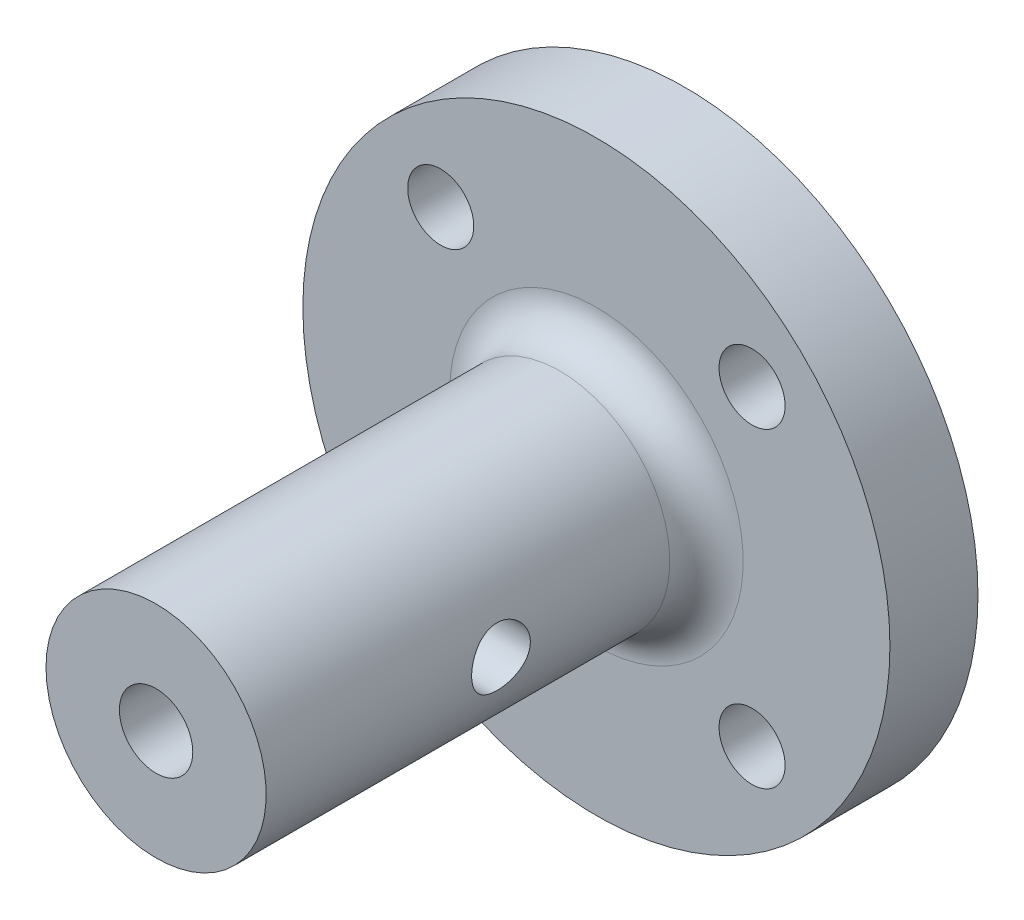
from build123d import *

# Parameters (mm, degrees)
SKETCH_2_R          = 5
CUT_EXTRUDE_1_DEPTH = 20
SKETCH_3_R          = 4
CUT_EXTRUDE_2_DEPTH = 81
SKETCH_4_R          = 4.5
CUT_EXTRUDE_3_DEPTH = 83.462112585
FILLET_1_R          = 5


with BuildPart() as part:
    # 草图1 → 旋转1 (revolve)
    with BuildSketch(Plane(origin=(0, 0, 0), x_dir=(1, 0, 0), z_dir=(0, 1, 0)), mode=Mode.PRIVATE) as revolve_1_sk:
        Polygon((0, 0), (40, 0), (40, -12), (15, -12), (15, -72), (0, -72), align=None)
    revolve(revolve_1_sk.sketch.rotate(Axis((0, 0, 0), (0, 0, 1)), 180), axis=Axis((0, 0, 0), (0, 0, 1)))

    # 草图2 → 切除-拉伸1 (cut)
    with BuildSketch(Plane.XY.offset(72)):
        Circle(SKETCH_2_R)
    extrude(amount=-CUT_EXTRUDE_1_DEPTH, mode=Mode.SUBTRACT)

    # 草图3 → 切除-拉伸2 (cut, symmetric)
    with BuildSketch(Plane(origin=(0, 0, 0), x_dir=(0, 0, -1), z_dir=(1, 0, 0))):
        with Locations((-40, 0)):
            Circle(SKETCH_3_R)
    extrude(amount=CUT_EXTRUDE_2_DEPTH, both=True, mode=Mode.SUBTRACT)

    # 草图4 → 切除-拉伸3 (cut, through all)
    with BuildSketch(Plane.XY.offset(12)):
        with Locations((21.213203, 21.213203)):
            Circle(SKETCH_4_R)
        with Locations((-21.213203, 21.213203)):
            Circle(SKETCH_4_R)
        with Locations((-21.213203, -21.213203)):
            Circle(SKETCH_4_R)
        with Locations((21.213203, -21.213203)):
            Circle(SKETCH_4_R)
    extrude(amount=-CUT_EXTRUDE_3_DEPTH, mode=Mode.SUBTRACT)

    # 圆角1
    fillet_1_edges = [part.edges().sort_by_distance(p)[0] for p in [
        (15, 0, 12),
    ]]
    fillet(fillet_1_edges, radius=FILLET_1_R)


solid = part.part
